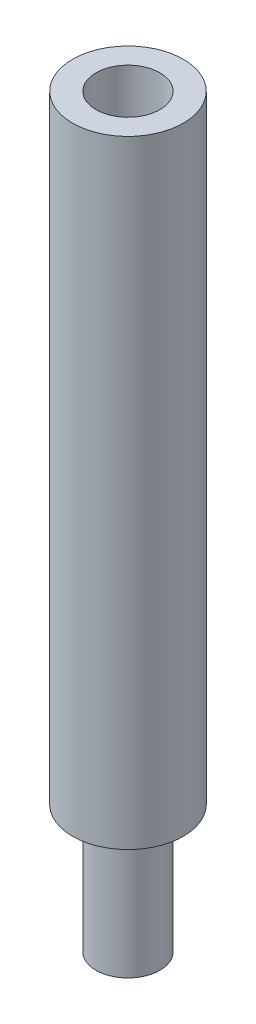
from build123d import *


with BuildPart() as part:
    # Sketch1 → Revolve1 (revolve)
    with BuildSketch(Plane(origin=(0, 0, 0), x_dir=(0, 0, -1), z_dir=(1, 0, 0))):
        Polygon((-2.6, 14.5), (-2.6, -14.5), (-1.5, -14.5), (-1.5, -20.5), (0, -20.5), (0, 8.5), (-1.5, 8.5), (-1.5, 14.5), align=None)
    revolve(axis=Axis((0, 27.539796734, 0), (0, -1, 0)))


solid = part.part
